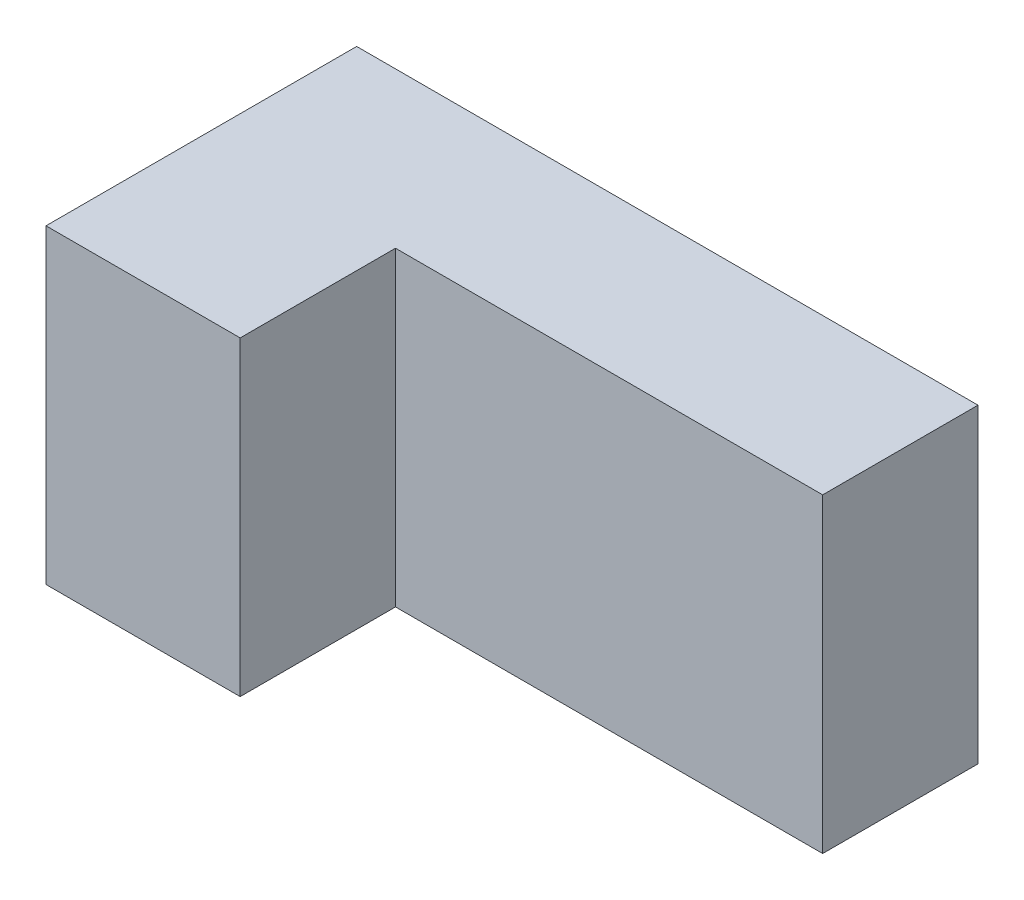
from build123d import *

# Parameters (mm, degrees)
SKETCH_1_W          = 80
SKETCH_1_H          = 40
EXTRUDE_1_DEPTH     = 20
SKETCH_2_W          = 25
SKETCH_2_H          = 40
EXTRUDE_2_DEPTH     = 20
SKETCH_3_R          = 9.55930051
CUT_EXTRUDE_1_DEPTH = 5


with BuildPart() as part:
    # 草图1 → 凸台-拉伸1 (new body)
    with BuildSketch(Plane.XY):
        Rectangle(SKETCH_1_W, SKETCH_1_H)
    extrude(amount=EXTRUDE_1_DEPTH)

    # 草图2 → 凸台-拉伸2 (add)
    with BuildSketch(Plane.XY.offset(20)):
        with Locations((-27.5, 0)):
            Rectangle(SKETCH_2_W, SKETCH_2_H)
    extrude(amount=EXTRUDE_2_DEPTH)

    # 草图3 → 切除-拉伸1 (cut)
    with BuildSketch(Plane.ZY.offset(40)):
        with Locations((21.858234258, 0)):
            Circle(SKETCH_3_R)
    extrude(amount=-CUT_EXTRUDE_1_DEPTH, mode=Mode.SUBTRACT)


solid = part.part
